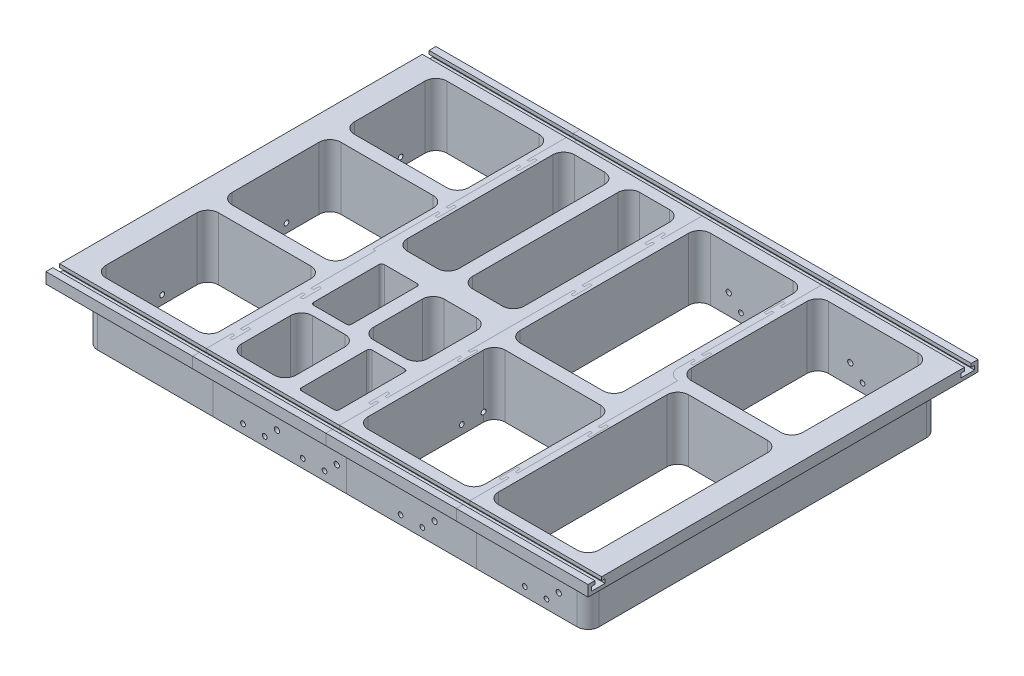
from build123d import *

# Parameters (mm, degrees)
SKETCH1_W                  = 399
SKETCH1_H                  = 287
BOSS_EXTRUDE1_DEPTH        = 53
SKETCH3_OUTSIDE_W          = 499.87
SKETCH3_OUTSIDE_H          = 387.87
SKETCH3_OUTSIDE_W_2        = 369
SKETCH3_OUTSIDE_H_2        = 257
CUT_EXTRUDE2_DEPTH         = 45
MINI_BIN_CUTS_DEPTH        = 46
FILLET1_R                  = 8
SKETCH6_W                  = 257
SKETCH6_H                  = 7
CUT_EXTRUDE5_DEPTH         = 414.348823634
SKETCH7_R                  = 1.75
SKETCH7_R_2                = 1.95
HOLES_LIDS_1_2_3_DEPTH     = 3
SKETCH8_R                  = 1.75
SKETCH8_R_2                = 1.95
HOLES_LIDS_8_9_12_13_DEPTH = 3
SKETCH9_R                  = 1.75
SKETCH9_R_2                = 1.95
HOLES_LIDS_4_5_10_11_DEPTH = 3
HOLE_LID_7_REACH           = 256.185
SKETCH11_R                 = 1.75
HOLE_START                 = -15
SKETCH12_R                 = 1.75
HOLE_LID_6_DEPTH           = 15
SKETCH13_R                 = 1.95
SERVO_BRACKETS_6_7_DEPTH   = 15
SPLIT2_SURFACE_1_1_BACK    = 494.646
SPLIT2_SURFACE_1_1_DEPTH   = 989.292
SPLIT2_SURFACE_1_2_BACK    = 494.646
SPLIT2_SURFACE_1_2_DEPTH   = 989.292
SPLIT2_SURFACE_2_3_BACK    = 494.646
SPLIT2_SURFACE_2_3_DEPTH   = 989.292
SPLIT2_SURFACE_2_4_BACK    = 494.646
SPLIT2_SURFACE_2_4_DEPTH   = 989.292
SPLIT2_SURFACE_3_5_BACK    = 494.646
SPLIT2_SURFACE_3_5_DEPTH   = 989.292
SPLIT2_SURFACE_3_6_BACK    = 494.646
SPLIT2_SURFACE_3_6_DEPTH   = 989.292
STRUCTURAL_CUTS_DEPTH      = 428.319845093


with BuildPart() as part:
    # Sketch1 → Boss-Extrude1 (new body)
    with BuildSketch(Plane(origin=(0, 0, 0), x_dir=(1, 0, 0), z_dir=(0, 1, 0))):
        Rectangle(SKETCH1_W, SKETCH1_H)
    extrude(amount=BOSS_EXTRUDE1_DEPTH)

    # Sketch3 outside → Cut-Extrude2 (cut)
    with BuildSketch(Plane(origin=(0, 0, 0), x_dir=(-1, 0, 0), z_dir=(0, -1, 0))):
        Rectangle(SKETCH3_OUTSIDE_W, SKETCH3_OUTSIDE_H)
        Rectangle(SKETCH3_OUTSIDE_W_2, SKETCH3_OUTSIDE_H_2, mode=Mode.SUBTRACT)
    extrude(amount=-CUT_EXTRUDE2_DEPTH, mode=Mode.SUBTRACT)

    # Sketch2 → Mini bin cuts (cut)
    with BuildSketch(Plane(origin=(0, 53, 0), x_dir=(1, 0, 0), z_dir=(0, 1, 0))):
        with BuildLine():
            Line((-173.5, -125.5), (-105.5, -125.5))
            ThreePointArc((-105.5, -125.5), (-99.843145751, -123.156854249), (-97.5, -117.5))
            Line((-97.5, -117.5), (-97.5, -50.5))
            ThreePointArc((-97.5, -50.5), (-99.843145751, -44.843145751), (-105.5, -42.5))
            Line((-105.5, -42.5), (-173.5, -42.5))
            ThreePointArc((-173.5, -42.5), (-179.156854249, -44.843145751), (-181.5, -50.5))
            Line((-181.5, -50.5), (-181.5, -117.5))
            ThreePointArc((-181.5, -117.5), (-179.156854249, -123.156854249), (-173.5, -125.5))
        make_face()
        with BuildLine():
            Line((-173.5, -32.5), (-105.5, -32.5))
            ThreePointArc((-105.5, -32.5), (-99.843145751, -30.156854249), (-97.5, -24.5))
            Line((-97.5, -24.5), (-97.5, 39.5))
            ThreePointArc((-97.5, 39.5), (-99.843145751, 45.156854249), (-105.5, 47.5))
            Line((-105.5, 47.5), (-173.5, 47.5))
            ThreePointArc((-173.5, 47.5), (-179.156854249, 45.156854249), (-181.5, 39.5))
            Line((-181.5, 39.5), (-181.5, -24.5))
            ThreePointArc((-181.5, -24.5), (-179.156854249, -30.156854249), (-173.5, -32.5))
        make_face()
        with BuildLine():
            Line((-173.5, 125.5), (-105.5, 125.5))
            ThreePointArc((-105.5, 125.5), (-99.843145751, 123.156854249), (-97.5, 117.5))
            Line((-97.5, 117.5), (-97.5, 65.5))
            ThreePointArc((-97.5, 65.5), (-99.843145751, 59.843145751), (-105.5, 57.5))
            Line((-105.5, 57.5), (-173.5, 57.5))
            ThreePointArc((-173.5, 57.5), (-179.156854249, 59.843145751), (-181.5, 65.5))
            Line((-181.5, 65.5), (-181.5, 117.5))
            ThreePointArc((-181.5, 117.5), (-179.156854249, 123.156854249), (-173.5, 125.5))
        make_face()
        with BuildLine():
            Line((173.5, -125.5), (115.5, -125.5))
            ThreePointArc((115.5, -125.5), (109.843145751, -123.156854249), (107.5, -117.5))
            Line((107.5, -117.5), (107.5, 6.5))
            ThreePointArc((107.5, 6.5), (109.843145751, 12.156854249), (115.5, 14.5))
            Line((115.5, 14.5), (173.5, 14.5))
            ThreePointArc((173.5, 14.5), (179.156854249, 12.156854249), (181.5, 6.5))
            Line((181.5, 6.5), (181.5, -117.5))
            ThreePointArc((181.5, -117.5), (179.156854249, -123.156854249), (173.5, -125.5))
        make_face()
        with BuildLine():
            Line((173.5, 125.5), (107.5, 125.5))
            ThreePointArc((107.5, 125.5), (101.843145751, 123.156854249), (99.5, 117.5))
            Line((99.5, 117.5), (99.5, 32.5))
            ThreePointArc((99.5, 32.5), (101.843145751, 26.843145751), (107.5, 24.5))
            Line((107.5, 24.5), (173.5, 24.5))
            ThreePointArc((173.5, 24.5), (179.156854249, 26.843145751), (181.5, 32.5))
            Line((181.5, 32.5), (181.5, 117.5))
            ThreePointArc((181.5, 117.5), (179.156854249, 123.156854249), (173.5, 125.5))
        make_face()
        with BuildLine():
            Line((81.5, 125.5), (20.5, 125.5))
            ThreePointArc((20.5, 125.5), (14.843145751, 123.156854249), (12.5, 117.5))
            Line((12.5, 117.5), (12.5, -6.5))
            ThreePointArc((12.5, -6.5), (14.843145751, -12.156854249), (20.5, -14.5))
            Line((20.5, -14.5), (81.5, -14.5))
            ThreePointArc((81.5, -14.5), (87.156854249, -12.156854249), (89.5, -6.5))
            Line((89.5, -6.5), (89.5, 117.5))
            ThreePointArc((89.5, 117.5), (87.156854249, 123.156854249), (81.5, 125.5))
        make_face()
        with BuildLine():
            Line((-9.5, 125.5), (-31.5, 125.5))
            ThreePointArc((-31.5, 125.5), (-37.156854249, 123.156854249), (-39.5, 117.5))
            Line((-39.5, 117.5), (-39.5, 10.5))
            ThreePointArc((-39.5, 10.5), (-37.156854249, 4.843145751), (-31.5, 2.5))
            Line((-31.5, 2.5), (-9.5, 2.5))
            ThreePointArc((-9.5, 2.5), (-3.843145751, 4.843145751), (-1.5, 10.5))
            Line((-1.5, 10.5), (-1.5, 117.5))
            ThreePointArc((-1.5, 117.5), (-3.843145751, 123.156854249), (-9.5, 125.5))
        make_face()
        with BuildLine():
            Line((-57.5, 125.5), (-79.5, 125.5))
            ThreePointArc((-79.5, 125.5), (-85.156854249, 123.156854249), (-87.5, 117.5))
            Line((-87.5, 117.5), (-87.5, 10.5))
            ThreePointArc((-87.5, 10.5), (-85.156854249, 4.843145751), (-79.5, 2.5))
            Line((-79.5, 2.5), (-57.5, 2.5))
            ThreePointArc((-57.5, 2.5), (-51.843145751, 4.843145751), (-49.5, 10.5))
            Line((-49.5, 10.5), (-49.5, 117.5))
            ThreePointArc((-49.5, 117.5), (-51.843145751, 123.156854249), (-57.5, 125.5))
        make_face()
        with BuildLine():
            Line((-79.5, -14.5), (-55.5, -14.5))
            ThreePointArc((-55.5, -14.5), (-54.085786438, -15.085786438), (-53.5, -16.5))
            Line((-53.5, -16.5), (-53.5, -64.5))
            ThreePointArc((-53.5, -64.5), (-54.085786438, -65.914213562), (-55.5, -66.5))
            Line((-55.5, -66.5), (-79.5, -66.5))
            ThreePointArc((-79.5, -66.5), (-80.914213562, -65.914213562), (-81.5, -64.5))
            Line((-81.5, -64.5), (-81.5, -16.5))
            ThreePointArc((-81.5, -16.5), (-80.914213562, -15.085786438), (-79.5, -14.5))
        make_face()
        with BuildLine():
            Line((-73.5, -125.5), (-49.5, -125.5))
            ThreePointArc((-49.5, -125.5), (-43.843145751, -123.156854249), (-41.5, -117.5))
            Line((-41.5, -117.5), (-41.5, -81.5))
            ThreePointArc((-41.5, -81.5), (-43.843145751, -75.843145751), (-49.5, -73.5))
            Line((-49.5, -73.5), (-73.5, -73.5))
            ThreePointArc((-73.5, -73.5), (-79.156854249, -75.843145751), (-81.5, -81.5))
            Line((-81.5, -81.5), (-81.5, -117.5))
            ThreePointArc((-81.5, -117.5), (-79.156854249, -123.156854249), (-73.5, -125.5))
        make_face()
        with BuildLine():
            Line((-35.5, -14.5), (-11.5, -14.5))
            ThreePointArc((-11.5, -14.5), (-5.843145751, -16.843145751), (-3.5, -22.5))
            Line((-3.5, -22.5), (-3.5, -58.5))
            ThreePointArc((-3.5, -58.5), (-5.843145751, -64.156854249), (-11.5, -66.5))
            Line((-11.5, -66.5), (-35.5, -66.5))
            ThreePointArc((-35.5, -66.5), (-41.156854249, -64.156854249), (-43.5, -58.5))
            Line((-43.5, -58.5), (-43.5, -22.5))
            ThreePointArc((-43.5, -22.5), (-41.156854249, -16.843145751), (-35.5, -14.5))
        make_face()
        with BuildLine():
            Line((-29.5, -73.5), (-5.5, -73.5))
            ThreePointArc((-5.5, -73.5), (-4.085786438, -74.085786438), (-3.5, -75.5))
            Line((-3.5, -75.5), (-3.5, -123.5))
            ThreePointArc((-3.5, -123.5), (-4.085786438, -124.914213562), (-5.5, -125.5))
            Line((-5.5, -125.5), (-29.5, -125.5))
            ThreePointArc((-29.5, -125.5), (-30.914213562, -124.914213562), (-31.5, -123.5))
            Line((-31.5, -123.5), (-31.5, -75.5))
            ThreePointArc((-31.5, -75.5), (-30.914213562, -74.085786438), (-29.5, -73.5))
        make_face()
        with BuildLine():
            Line((89.5, -125.5), (19.5, -125.5))
            ThreePointArc((19.5, -125.5), (13.843145751, -123.156854249), (11.5, -117.5))
            Line((11.5, -117.5), (11.5, -32.5))
            ThreePointArc((11.5, -32.5), (13.843145751, -26.843145751), (19.5, -24.5))
            Line((19.5, -24.5), (89.5, -24.5))
            ThreePointArc((89.5, -24.5), (95.156854249, -26.843145751), (97.5, -32.5))
            Line((97.5, -32.5), (97.5, -117.5))
            ThreePointArc((97.5, -117.5), (95.156854249, -123.156854249), (89.5, -125.5))
        make_face()
    extrude(amount=-MINI_BIN_CUTS_DEPTH, mode=Mode.SUBTRACT)

    # Fillet1
    fillet1_edges = [part.edges().sort_by_distance(p)[0] for p in [
        (184.5, 22.5, 128.5),
        (184.5, 22.5, -128.5),
        (-184.5, 22.5, -128.5),
        (-184.5, 22.5, 128.5),
    ]]
    fillet(fillet1_edges, radius=FILLET1_R)

    # Sketch6 → Cut-Extrude5 (cut, through all)
    with BuildSketch(Plane.ZY.offset(184.5)):
        with Locations((0, 3.5)):
            Rectangle(SKETCH6_W, SKETCH6_H)
    extrude(amount=-CUT_EXTRUDE5_DEPTH, mode=Mode.SUBTRACT)

    # Sketch7 → Holes Lids 1,2,3 (cut)
    with BuildSketch(Plane.ZY.offset(184.5)):
        with Locations((-99.5, 13.5)):
            Circle(SKETCH7_R)
        with Locations((-83.5, 13.5)):
            Circle(SKETCH7_R)
        with Locations((-15.5, 13.5)):
            Circle(SKETCH7_R)
        with Locations((76, 13.5)):
            Circle(SKETCH7_R)
        with Locations((0.5, 13.5)):
            Circle(SKETCH7_R)
        with Locations((92, 13.5)):
            Circle(SKETCH7_R)
        with Locations((-74.5, 21.963)):
            Circle(SKETCH7_R_2)
        with Locations((101, 21.963)):
            Circle(SKETCH7_R_2)
        with Locations((9.5, 21.963)):
            Circle(SKETCH7_R_2)
    extrude(amount=-HOLES_LIDS_1_2_3_DEPTH, mode=Mode.SUBTRACT)

    # Sketch8 → Holes Lids 8,9,12,13 (cut)
    with BuildSketch(Plane.XY.offset(128.5)):
        with Locations((-69.5, 13.5)):
            Circle(SKETCH8_R)
        with Locations((-25.5, 13.5)):
            Circle(SKETCH8_R)
        with Locations((46.5, 13.5)):
            Circle(SKETCH8_R)
        with Locations((137.896, 13.5)):
            Circle(SKETCH8_R)
        with Locations((153.896, 13.5)):
            Circle(SKETCH8_R)
        with Locations((62.5, 13.5)):
            Circle(SKETCH8_R)
        with Locations((-9.5, 13.5)):
            Circle(SKETCH8_R)
        with Locations((-53.5, 13.5)):
            Circle(SKETCH8_R)
        with Locations((-44.5, 21.96)):
            Circle(SKETCH8_R_2)
        with Locations((-0.5, 21.96)):
            Circle(SKETCH8_R_2)
        with Locations((71.5, 21.96)):
            Circle(SKETCH8_R_2)
        with Locations((162.896, 21.96)):
            Circle(SKETCH8_R_2)
    extrude(amount=-HOLES_LIDS_8_9_12_13_DEPTH, mode=Mode.SUBTRACT)

    # Sketch9 → Holes Lids 4,5,10,11 (cut)
    with BuildSketch(Plane(origin=(0, 0, -128.5), x_dir=(-1, 0, 0), z_dir=(0, 0, -1))):
        with Locations((-148.5, 13.5)):
            Circle(SKETCH9_R)
        with Locations((-59, 13.5)):
            Circle(SKETCH9_R)
        with Locations((12.5, 13.5)):
            Circle(SKETCH9_R)
        with Locations((60.5, 13.5)):
            Circle(SKETCH9_R)
        with Locations((-132.5, 13.5)):
            Circle(SKETCH9_R)
        with Locations((-43, 13.5)):
            Circle(SKETCH9_R)
        with Locations((28.5, 13.5)):
            Circle(SKETCH9_R)
        with Locations((76.5, 13.5)):
            Circle(SKETCH9_R)
        with Locations((-123.5, 21.96)):
            Circle(SKETCH9_R_2)
        with Locations((-34, 21.96)):
            Circle(SKETCH9_R_2)
        with Locations((37.5, 21.96)):
            Circle(SKETCH9_R_2)
        with Locations((85.5, 21.96)):
            Circle(SKETCH9_R_2)
    extrude(amount=-HOLES_LIDS_4_5_10_11_DEPTH, mode=Mode.SUBTRACT)

    # Sketch11 → Hole Lid 7 (cut, up to next)
    with BuildSketch(Plane.ZY.offset(3.5), mode=Mode.PRIVATE) as hole_lid_7_sk1:
        with Locations((32.5, 13.5)):
            Circle(SKETCH11_R)
    hole_lid_7_tool1 = extrude(hole_lid_7_sk1.sketch, amount=-HOLE_LID_7_REACH, mode=Mode.PRIVATE) & part.part
    # Sketch11 → Hole Lid 7 (cut, up to next)
    with BuildSketch(Plane.ZY.offset(3.5), mode=Mode.PRIVATE) as hole_lid_7_sk2:
        with Locations((48.5, 13.5)):
            Circle(SKETCH11_R)
    hole_lid_7_tool2 = extrude(hole_lid_7_sk2.sketch, amount=-HOLE_LID_7_REACH, mode=Mode.PRIVATE) & part.part
    add(hole_lid_7_tool1.solids().sort_by_distance((-3.5, 13.5, 32.5))[0], mode=Mode.SUBTRACT)
    add(hole_lid_7_tool2.solids().sort_by_distance((-3.5, 13.5, 48.5))[0], mode=Mode.SUBTRACT)

    # Sketch12 → Hole Lid 6 (cut)
    with BuildSketch(Plane(origin=(-81.5, 0, 0), x_dir=(0, 0, -1), z_dir=(1, 0, 0)).offset(HOLE_START)):
        with Locations(Location((-48.5, 13.5, 0), (0, 0, 180))):
            Circle(SKETCH12_R)
        with Locations(Location((-32.5, 13.5, 0), (0, 0, 180))):
            Circle(SKETCH12_R)
    extrude(amount=HOLE_LID_6_DEPTH, mode=Mode.SUBTRACT)

    # Sketch13 → Servo brackets 6,7, (cut)
    with BuildSketch(Plane.XZ.offset(-7)):
        with Locations(Location((-88.5, 46.5, 0), (0, 0, 270))):
            Circle(SKETCH13_R)
        with Locations(Location((-88.5, 6.37, 0), (0, 0, 90))):
            Circle(SKETCH13_R)
        with Locations(Location((3.5, 17.84, 0), (0, 0, 270))):
            Circle(SKETCH13_R)
        with Locations(Location((3.5, 57.97, 0), (0, 0, 90))):
            Circle(SKETCH13_R)
    extrude(amount=-SERVO_BRACKETS_6_7_DEPTH, mode=Mode.SUBTRACT)


with BuildPart() as body_2:
    # Split2: the piece behind the surface
    add(part.part)
    # Split2 surface 1: a surface, the sketch's curves swept straight by 989.292 mm
    with BuildLine(Plane(origin=(0, 53, 0), x_dir=(1, 0, 0), z_dir=(0, 1, 0)).offset(-SPLIT2_SURFACE_1_1_BACK), mode=Mode.PRIVATE) as split2_surface_1_1_path:
        Line((6.5, 143.5), (6.5, 104.5))
        Line((6.5, 104.5), (5.5, 104.5))
        ThreePointArc((5.5, 104.5), (4.969669914, 104.719669914), (4.75, 105.25))
        Line((4.75, 105.25), (4.75, 107.75))
        ThreePointArc((4.75, 107.75), (4.530330086, 108.280330086), (4, 108.5))
        Line((4, 108.5), (3.5, 108.5))
        ThreePointArc((3.5, 108.5), (2.969669914, 108.280330086), (2.75, 107.75))
        Line((2.75, 107.75), (2.75, 95.25))
        ThreePointArc((2.75, 95.25), (2.969669914, 94.719669914), (3.5, 94.5))
        Line((3.5, 94.5), (4, 94.5))
        ThreePointArc((4, 94.5), (4.530330086, 94.719669914), (4.75, 95.25))
        Line((4.75, 95.25), (4.75, 97.75))
        ThreePointArc((4.75, 97.75), (4.969669914, 98.280330086), (5.5, 98.5))
        Line((5.5, 98.5), (6.5, 98.5))
        Line((6.5, 98.5), (6.5, 45))
        Line((6.5, 45), (8.25, 45))
        Line((8.25, 45), (8.25, 48.25))
        ThreePointArc((8.25, 48.25), (8.469669914, 48.780330086), (9, 49))
        Line((9, 49), (9.5, 49))
        ThreePointArc((9.5, 49), (10.030330086, 48.780330086), (10.25, 48.25))
        Line((10.25, 48.25), (10.25, 35.75))
        ThreePointArc((10.25, 35.75), (10.030330086, 35.219669914), (9.5, 35))
        Line((9.5, 35), (9, 35))
        ThreePointArc((9, 35), (8.469669914, 35.219669914), (8.25, 35.75))
        Line((8.25, 35.75), (8.25, 38.25))
        ThreePointArc((8.25, 38.25), (8.030330086, 38.780330086), (7.5, 39))
        Line((7.5, 39), (7.25, 39))
        ThreePointArc((7.25, 39), (6.719669914, 38.780330086), (6.5, 38.25))
        Line((6.5, 38.25), (6.5, -39))
        Line((6.5, -39), (7.5, -39))
        ThreePointArc((7.5, -39), (8.030330086, -38.780330086), (8.25, -38.25))
        Line((8.25, -38.25), (8.25, -35.75))
        ThreePointArc((8.25, -35.75), (8.469669914, -35.219669914), (9, -35))
        Line((9, -35), (9.5, -35))
        ThreePointArc((9.5, -35), (10.030330086, -35.219669914), (10.25, -35.75))
        Line((10.25, -35.75), (10.25, -48.25))
        ThreePointArc((10.25, -48.25), (10.030330086, -48.780330086), (9.5, -49))
        Line((9.5, -49), (9, -49))
        ThreePointArc((9, -49), (8.469669914, -48.780330086), (8.25, -48.25))
        Line((8.25, -48.25), (8.25, -45.75))
        ThreePointArc((8.25, -45.75), (8.030330086, -45.219669914), (7.5, -45))
        Line((7.5, -45), (6.5, -45))
        Line((6.5, -45), (6.5, -98.5))
        Line((6.5, -98.5), (5.5, -98.5))
        ThreePointArc((5.5, -98.5), (4.969669914, -98.280330086), (4.75, -97.75))
        Line((4.75, -97.75), (4.75, -95.25))
        ThreePointArc((4.75, -95.25), (4.530330086, -94.719669914), (4, -94.5))
        Line((4, -94.5), (3.5, -94.5))
        ThreePointArc((3.5, -94.5), (2.969669914, -94.719669914), (2.75, -95.25))
        Line((2.75, -95.25), (2.75, -107.75))
        ThreePointArc((2.75, -107.75), (2.969669914, -108.280330086), (3.5, -108.5))
        Line((3.5, -108.5), (4, -108.5))
        ThreePointArc((4, -108.5), (4.530330086, -108.280330086), (4.75, -107.75))
        Line((4.75, -107.75), (4.75, -105.25))
        ThreePointArc((4.75, -105.25), (4.969669914, -104.719669914), (5.5, -104.5))
        Line((5.5, -104.5), (6.5, -104.5))
        Line((6.5, -104.5), (6.5, -143.5))
    split2_surface_1_1 = Shell.extrude(split2_surface_1_1_path.wire(), (0 * SPLIT2_SURFACE_1_1_DEPTH, 1 * SPLIT2_SURFACE_1_1_DEPTH, 0 * SPLIT2_SURFACE_1_1_DEPTH))
    split(bisect_by=split2_surface_1_1, keep=Keep.BOTTOM)


with BuildPart() as part_1:
    add(part.part)

    # Split2: split by a surface, the side it looks to stays
    # Split2 surface 1: a surface, the sketch's curves swept straight by 989.292 mm
    with BuildLine(Plane(origin=(0, 53, 0), x_dir=(1, 0, 0), z_dir=(0, 1, 0)).offset(-SPLIT2_SURFACE_1_2_BACK), mode=Mode.PRIVATE) as split2_surface_1_2_path:
        Line((6.5, 143.5), (6.5, 104.5))
        Line((6.5, 104.5), (5.5, 104.5))
        ThreePointArc((5.5, 104.5), (4.969669914, 104.719669914), (4.75, 105.25))
        Line((4.75, 105.25), (4.75, 107.75))
        ThreePointArc((4.75, 107.75), (4.530330086, 108.280330086), (4, 108.5))
        Line((4, 108.5), (3.5, 108.5))
        ThreePointArc((3.5, 108.5), (2.969669914, 108.280330086), (2.75, 107.75))
        Line((2.75, 107.75), (2.75, 95.25))
        ThreePointArc((2.75, 95.25), (2.969669914, 94.719669914), (3.5, 94.5))
        Line((3.5, 94.5), (4, 94.5))
        ThreePointArc((4, 94.5), (4.530330086, 94.719669914), (4.75, 95.25))
        Line((4.75, 95.25), (4.75, 97.75))
        ThreePointArc((4.75, 97.75), (4.969669914, 98.280330086), (5.5, 98.5))
        Line((5.5, 98.5), (6.5, 98.5))
        Line((6.5, 98.5), (6.5, 45))
        Line((6.5, 45), (8.25, 45))
        Line((8.25, 45), (8.25, 48.25))
        ThreePointArc((8.25, 48.25), (8.469669914, 48.780330086), (9, 49))
        Line((9, 49), (9.5, 49))
        ThreePointArc((9.5, 49), (10.030330086, 48.780330086), (10.25, 48.25))
        Line((10.25, 48.25), (10.25, 35.75))
        ThreePointArc((10.25, 35.75), (10.030330086, 35.219669914), (9.5, 35))
        Line((9.5, 35), (9, 35))
        ThreePointArc((9, 35), (8.469669914, 35.219669914), (8.25, 35.75))
        Line((8.25, 35.75), (8.25, 38.25))
        ThreePointArc((8.25, 38.25), (8.030330086, 38.780330086), (7.5, 39))
        Line((7.5, 39), (7.25, 39))
        ThreePointArc((7.25, 39), (6.719669914, 38.780330086), (6.5, 38.25))
        Line((6.5, 38.25), (6.5, -39))
        Line((6.5, -39), (7.5, -39))
        ThreePointArc((7.5, -39), (8.030330086, -38.780330086), (8.25, -38.25))
        Line((8.25, -38.25), (8.25, -35.75))
        ThreePointArc((8.25, -35.75), (8.469669914, -35.219669914), (9, -35))
        Line((9, -35), (9.5, -35))
        ThreePointArc((9.5, -35), (10.030330086, -35.219669914), (10.25, -35.75))
        Line((10.25, -35.75), (10.25, -48.25))
        ThreePointArc((10.25, -48.25), (10.030330086, -48.780330086), (9.5, -49))
        Line((9.5, -49), (9, -49))
        ThreePointArc((9, -49), (8.469669914, -48.780330086), (8.25, -48.25))
        Line((8.25, -48.25), (8.25, -45.75))
        ThreePointArc((8.25, -45.75), (8.030330086, -45.219669914), (7.5, -45))
        Line((7.5, -45), (6.5, -45))
        Line((6.5, -45), (6.5, -98.5))
        Line((6.5, -98.5), (5.5, -98.5))
        ThreePointArc((5.5, -98.5), (4.969669914, -98.280330086), (4.75, -97.75))
        Line((4.75, -97.75), (4.75, -95.25))
        ThreePointArc((4.75, -95.25), (4.530330086, -94.719669914), (4, -94.5))
        Line((4, -94.5), (3.5, -94.5))
        ThreePointArc((3.5, -94.5), (2.969669914, -94.719669914), (2.75, -95.25))
        Line((2.75, -95.25), (2.75, -107.75))
        ThreePointArc((2.75, -107.75), (2.969669914, -108.280330086), (3.5, -108.5))
        Line((3.5, -108.5), (4, -108.5))
        ThreePointArc((4, -108.5), (4.530330086, -108.280330086), (4.75, -107.75))
        Line((4.75, -107.75), (4.75, -105.25))
        ThreePointArc((4.75, -105.25), (4.969669914, -104.719669914), (5.5, -104.5))
        Line((5.5, -104.5), (6.5, -104.5))
        Line((6.5, -104.5), (6.5, -143.5))
    split2_surface_1_2 = Shell.extrude(split2_surface_1_2_path.wire(), (0 * SPLIT2_SURFACE_1_2_DEPTH, 1 * SPLIT2_SURFACE_1_2_DEPTH, 0 * SPLIT2_SURFACE_1_2_DEPTH))
    split(bisect_by=split2_surface_1_2, keep=Keep.TOP)


with BuildPart() as body_3:
    # Split2 2: the piece behind the surface
    add(part_1.part)
    # Split2 surface 2: a surface, the sketch's curves swept straight by 989.292 mm
    with BuildLine(Plane(origin=(0, 53, 0), x_dir=(1, 0, 0), z_dir=(0, 1, 0)).offset(-SPLIT2_SURFACE_2_3_BACK), mode=Mode.PRIVATE) as split2_surface_2_3_path:
        Line((102.5, -143.5), (102.5, -104.5))
        Line((102.5, -104.5), (101.5, -104.5))
        ThreePointArc((101.5, -104.5), (100.969669914, -104.719669914), (100.75, -105.25))
        Line((100.75, -105.25), (100.75, -107.75))
        ThreePointArc((100.75, -107.75), (100.530330086, -108.280330086), (100, -108.5))
        Line((100, -108.5), (99.5, -108.5))
        ThreePointArc((99.5, -108.5), (98.969669914, -108.280330086), (98.75, -107.75))
        Line((98.75, -107.75), (98.75, -95.25))
        ThreePointArc((98.75, -95.25), (98.969669914, -94.719669914), (99.5, -94.5))
        Line((99.5, -94.5), (100, -94.5))
        ThreePointArc((100, -94.5), (100.530330086, -94.719669914), (100.75, -95.25))
        Line((100.75, -95.25), (100.75, -97.75))
        ThreePointArc((100.75, -97.75), (100.969669914, -98.280330086), (101.5, -98.5))
        Line((101.5, -98.5), (102.5, -98.5))
        Line((102.5, -98.5), (102.5, -45))
        Line((102.5, -45), (103.5, -45))
        ThreePointArc((103.5, -45), (104.030330086, -45.219669914), (104.25, -45.75))
        Line((104.25, -45.75), (104.25, -48.25))
        ThreePointArc((104.25, -48.25), (104.469669914, -48.780330086), (105, -49))
        Line((105, -49), (105.5, -49))
        ThreePointArc((105.5, -49), (106.030330086, -48.780330086), (106.25, -48.25))
        Line((106.25, -48.25), (106.25, -35.75))
        ThreePointArc((106.25, -35.75), (106.030330086, -35.219669914), (105.5, -35))
        Line((105.5, -35), (105, -35))
        ThreePointArc((105, -35), (104.469669914, -35.219669914), (104.25, -35.75))
        Line((104.25, -35.75), (104.25, -38.25))
        ThreePointArc((104.25, -38.25), (104.030330086, -38.780330086), (103.5, -39))
        Line((103.5, -39), (102.5, -39))
        Line((102.5, -39), (102.5, 19.5))
        ThreePointArc((102.5, 19.5), (96.843145751, 21.843145751), (94.5, 27.5))
        Line((94.5, 27.5), (94.5, 39))
        Line((94.5, 39), (95.5, 39))
        ThreePointArc((95.5, 39), (96.030330086, 38.780330086), (96.25, 38.25))
        Line((96.25, 38.25), (96.25, 35.75))
        ThreePointArc((96.25, 35.75), (96.469669914, 35.219669914), (97, 35))
        Line((97, 35), (97.5, 35))
        ThreePointArc((97.5, 35), (98.030330086, 35.219669914), (98.25, 35.75))
        Line((98.25, 35.75), (98.25, 48.25))
        ThreePointArc((98.25, 48.25), (98.030330086, 48.780330086), (97.5, 49))
        Line((97.5, 49), (97, 49))
        ThreePointArc((97, 49), (96.469669914, 48.780330086), (96.25, 48.25))
        Line((96.25, 48.25), (96.25, 45.75))
        ThreePointArc((96.25, 45.75), (96.030330086, 45.219669914), (95.5, 45))
        Line((95.5, 45), (94.5, 45))
        Line((94.5, 45), (94.5, 98.5))
        Line((94.5, 98.5), (93.5, 98.5))
        ThreePointArc((93.5, 98.5), (92.969669914, 98.280330086), (92.75, 97.75))
        Line((92.75, 97.75), (92.75, 95.25))
        ThreePointArc((92.75, 95.25), (92.530330086, 94.719669914), (92, 94.5))
        Line((92, 94.5), (91.5, 94.5))
        ThreePointArc((91.5, 94.5), (90.969669914, 94.719669914), (90.75, 95.25))
        Line((90.75, 95.25), (90.75, 107.75))
        ThreePointArc((90.75, 107.75), (90.969669914, 108.280330086), (91.5, 108.5))
        Line((91.5, 108.5), (92, 108.5))
        ThreePointArc((92, 108.5), (92.530330086, 108.280330086), (92.75, 107.75))
        Line((92.75, 107.75), (92.75, 105.25))
        ThreePointArc((92.75, 105.25), (92.969669914, 104.719669914), (93.5, 104.5))
        Line((93.5, 104.5), (94.5, 104.5))
        Line((94.5, 104.5), (94.5, 143.5))
    split2_surface_2_3 = Shell.extrude(split2_surface_2_3_path.wire(), (0 * SPLIT2_SURFACE_2_3_DEPTH, 1 * SPLIT2_SURFACE_2_3_DEPTH, 0 * SPLIT2_SURFACE_2_3_DEPTH))
    split(bisect_by=split2_surface_2_3, keep=Keep.BOTTOM)


with BuildPart() as part_2:
    add(part_1.part)

    # Split2 2: split by a surface, the side it looks to stays
    # Split2 surface 2: a surface, the sketch's curves swept straight by 989.292 mm
    with BuildLine(Plane(origin=(0, 53, 0), x_dir=(1, 0, 0), z_dir=(0, 1, 0)).offset(-SPLIT2_SURFACE_2_4_BACK), mode=Mode.PRIVATE) as split2_surface_2_4_path:
        Line((102.5, -143.5), (102.5, -104.5))
        Line((102.5, -104.5), (101.5, -104.5))
        ThreePointArc((101.5, -104.5), (100.969669914, -104.719669914), (100.75, -105.25))
        Line((100.75, -105.25), (100.75, -107.75))
        ThreePointArc((100.75, -107.75), (100.530330086, -108.280330086), (100, -108.5))
        Line((100, -108.5), (99.5, -108.5))
        ThreePointArc((99.5, -108.5), (98.969669914, -108.280330086), (98.75, -107.75))
        Line((98.75, -107.75), (98.75, -95.25))
        ThreePointArc((98.75, -95.25), (98.969669914, -94.719669914), (99.5, -94.5))
        Line((99.5, -94.5), (100, -94.5))
        ThreePointArc((100, -94.5), (100.530330086, -94.719669914), (100.75, -95.25))
        Line((100.75, -95.25), (100.75, -97.75))
        ThreePointArc((100.75, -97.75), (100.969669914, -98.280330086), (101.5, -98.5))
        Line((101.5, -98.5), (102.5, -98.5))
        Line((102.5, -98.5), (102.5, -45))
        Line((102.5, -45), (103.5, -45))
        ThreePointArc((103.5, -45), (104.030330086, -45.219669914), (104.25, -45.75))
        Line((104.25, -45.75), (104.25, -48.25))
        ThreePointArc((104.25, -48.25), (104.469669914, -48.780330086), (105, -49))
        Line((105, -49), (105.5, -49))
        ThreePointArc((105.5, -49), (106.030330086, -48.780330086), (106.25, -48.25))
        Line((106.25, -48.25), (106.25, -35.75))
        ThreePointArc((106.25, -35.75), (106.030330086, -35.219669914), (105.5, -35))
        Line((105.5, -35), (105, -35))
        ThreePointArc((105, -35), (104.469669914, -35.219669914), (104.25, -35.75))
        Line((104.25, -35.75), (104.25, -38.25))
        ThreePointArc((104.25, -38.25), (104.030330086, -38.780330086), (103.5, -39))
        Line((103.5, -39), (102.5, -39))
        Line((102.5, -39), (102.5, 19.5))
        ThreePointArc((102.5, 19.5), (96.843145751, 21.843145751), (94.5, 27.5))
        Line((94.5, 27.5), (94.5, 39))
        Line((94.5, 39), (95.5, 39))
        ThreePointArc((95.5, 39), (96.030330086, 38.780330086), (96.25, 38.25))
        Line((96.25, 38.25), (96.25, 35.75))
        ThreePointArc((96.25, 35.75), (96.469669914, 35.219669914), (97, 35))
        Line((97, 35), (97.5, 35))
        ThreePointArc((97.5, 35), (98.030330086, 35.219669914), (98.25, 35.75))
        Line((98.25, 35.75), (98.25, 48.25))
        ThreePointArc((98.25, 48.25), (98.030330086, 48.780330086), (97.5, 49))
        Line((97.5, 49), (97, 49))
        ThreePointArc((97, 49), (96.469669914, 48.780330086), (96.25, 48.25))
        Line((96.25, 48.25), (96.25, 45.75))
        ThreePointArc((96.25, 45.75), (96.030330086, 45.219669914), (95.5, 45))
        Line((95.5, 45), (94.5, 45))
        Line((94.5, 45), (94.5, 98.5))
        Line((94.5, 98.5), (93.5, 98.5))
        ThreePointArc((93.5, 98.5), (92.969669914, 98.280330086), (92.75, 97.75))
        Line((92.75, 97.75), (92.75, 95.25))
        ThreePointArc((92.75, 95.25), (92.530330086, 94.719669914), (92, 94.5))
        Line((92, 94.5), (91.5, 94.5))
        ThreePointArc((91.5, 94.5), (90.969669914, 94.719669914), (90.75, 95.25))
        Line((90.75, 95.25), (90.75, 107.75))
        ThreePointArc((90.75, 107.75), (90.969669914, 108.280330086), (91.5, 108.5))
        Line((91.5, 108.5), (92, 108.5))
        ThreePointArc((92, 108.5), (92.530330086, 108.280330086), (92.75, 107.75))
        Line((92.75, 107.75), (92.75, 105.25))
        ThreePointArc((92.75, 105.25), (92.969669914, 104.719669914), (93.5, 104.5))
        Line((93.5, 104.5), (94.5, 104.5))
        Line((94.5, 104.5), (94.5, 143.5))
    split2_surface_2_4 = Shell.extrude(split2_surface_2_4_path.wire(), (0 * SPLIT2_SURFACE_2_4_DEPTH, 1 * SPLIT2_SURFACE_2_4_DEPTH, 0 * SPLIT2_SURFACE_2_4_DEPTH))
    split(bisect_by=split2_surface_2_4, keep=Keep.TOP)


with BuildPart() as body_4_2:
    # Split2 3 body 2: the piece behind the surface
    add(body_2.part)
    # Split2 surface 3: a surface, the sketch's curves swept straight by 989.292 mm
    with BuildLine(Plane(origin=(0, 53, 0), x_dir=(1, 0, 0), z_dir=(0, 1, 0)).offset(-SPLIT2_SURFACE_3_5_BACK), mode=Mode.PRIVATE) as split2_surface_3_5_path:
        Line((-93.5, 143.5), (-93.5, 104.5))
        Line((-93.5, 104.5), (-92.5, 104.5))
        ThreePointArc((-92.5, 104.5), (-91.969669914, 104.719669914), (-91.75, 105.25))
        Line((-91.75, 105.25), (-91.75, 107.75))
        ThreePointArc((-91.75, 107.75), (-91.530330086, 108.280330086), (-91, 108.5))
        Line((-91, 108.5), (-90.5, 108.5))
        ThreePointArc((-90.5, 108.5), (-89.969669914, 108.280330086), (-89.75, 107.75))
        Line((-89.75, 107.75), (-89.75, 95.25))
        ThreePointArc((-89.75, 95.25), (-89.969669914, 94.719669914), (-90.5, 94.5))
        Line((-90.5, 94.5), (-91, 94.5))
        ThreePointArc((-91, 94.5), (-91.530330086, 94.719669914), (-91.75, 95.25))
        Line((-91.75, 95.25), (-91.75, 97.75))
        ThreePointArc((-91.75, 97.75), (-91.969669914, 98.280330086), (-92.5, 98.5))
        Line((-92.5, 98.5), (-93.5, 98.5))
        Line((-93.5, 98.5), (-93.5, 45))
        Line((-93.5, 45), (-92.5, 45))
        ThreePointArc((-92.5, 45), (-91.969669914, 45.219669914), (-91.75, 45.75))
        Line((-91.75, 45.75), (-91.75, 48.25))
        ThreePointArc((-91.75, 48.25), (-91.530330086, 48.780330086), (-91, 49))
        Line((-91, 49), (-90.5, 49))
        ThreePointArc((-90.5, 49), (-89.969669914, 48.780330086), (-89.75, 48.25))
        Line((-89.75, 48.25), (-89.75, 35.75))
        ThreePointArc((-89.75, 35.75), (-89.969669914, 35.219669914), (-90.5, 35))
        Line((-90.5, 35), (-91, 35))
        ThreePointArc((-91, 35), (-91.530330086, 35.219669914), (-91.75, 35.75))
        Line((-91.75, 35.75), (-91.75, 38.25))
        ThreePointArc((-91.75, 38.25), (-91.969669914, 38.780330086), (-92.5, 39))
        Line((-92.5, 39), (-93.5, 39))
        Line((-93.5, 39), (-93.5, -8))
        ThreePointArc((-93.5, -8), (-93.207106781, -8.707106781), (-92.5, -9))
        Line((-92.5, -9), (-91.5, -9))
        Line((-91.5, -9), (-91.5, -56.5))
        Line((-91.5, -56.5), (-90.25, -56.5))
        ThreePointArc((-90.25, -56.5), (-89.719669914, -56.280330086), (-89.5, -55.75))
        Line((-89.5, -55.75), (-89.5, -53.25))
        ThreePointArc((-89.5, -53.25), (-89.280330086, -52.719669914), (-88.75, -52.5))
        Line((-88.75, -52.5), (-88.25, -52.5))
        ThreePointArc((-88.25, -52.5), (-87.719669914, -52.719669914), (-87.5, -53.25))
        Line((-87.5, -53.25), (-87.5, -65.75))
        ThreePointArc((-87.5, -65.75), (-87.719669914, -66.280330086), (-88.25, -66.5))
        Line((-88.25, -66.5), (-88.75, -66.5))
        ThreePointArc((-88.75, -66.5), (-89.280330086, -66.280330086), (-89.5, -65.75))
        Line((-89.5, -65.75), (-89.5, -63.25))
        ThreePointArc((-89.5, -63.25), (-89.719669914, -62.719669914), (-90.25, -62.5))
        Line((-90.25, -62.5), (-91.5, -62.5))
        Line((-91.5, -62.5), (-91.5, -108.5))
        Line((-91.5, -108.5), (-90.25, -108.5))
        ThreePointArc((-90.25, -108.5), (-89.719669914, -108.280330086), (-89.5, -107.75))
        Line((-89.5, -107.75), (-89.5, -105.25))
        ThreePointArc((-89.5, -105.25), (-89.280330086, -104.719669914), (-88.75, -104.5))
        Line((-88.75, -104.5), (-88.25, -104.5))
        ThreePointArc((-88.25, -104.5), (-87.719669914, -104.719669914), (-87.5, -105.25))
        Line((-87.5, -105.25), (-87.5, -117.75))
        ThreePointArc((-87.5, -117.75), (-87.719669914, -118.280330086), (-88.25, -118.5))
        Line((-88.25, -118.5), (-88.75, -118.5))
        ThreePointArc((-88.75, -118.5), (-89.280330086, -118.280330086), (-89.5, -117.75))
        Line((-89.5, -117.75), (-89.5, -115.25))
        ThreePointArc((-89.5, -115.25), (-89.719669914, -114.719669914), (-90.25, -114.5))
        Line((-90.25, -114.5), (-91.5, -114.5))
        Line((-91.5, -114.5), (-91.5, -143.5))
    split2_surface_3_5 = Shell.extrude(split2_surface_3_5_path.wire(), (0 * SPLIT2_SURFACE_3_5_DEPTH, 1 * SPLIT2_SURFACE_3_5_DEPTH, 0 * SPLIT2_SURFACE_3_5_DEPTH))
    split(bisect_by=split2_surface_3_5, keep=Keep.BOTTOM)


with BuildPart() as body_2_1:
    add(body_2.part)

    # Split2 3 body 2: split by a surface, the side it looks to stays
    # Split2 surface 3: a surface, the sketch's curves swept straight by 989.292 mm
    with BuildLine(Plane(origin=(0, 53, 0), x_dir=(1, 0, 0), z_dir=(0, 1, 0)).offset(-SPLIT2_SURFACE_3_6_BACK), mode=Mode.PRIVATE) as split2_surface_3_6_path:
        Line((-93.5, 143.5), (-93.5, 104.5))
        Line((-93.5, 104.5), (-92.5, 104.5))
        ThreePointArc((-92.5, 104.5), (-91.969669914, 104.719669914), (-91.75, 105.25))
        Line((-91.75, 105.25), (-91.75, 107.75))
        ThreePointArc((-91.75, 107.75), (-91.530330086, 108.280330086), (-91, 108.5))
        Line((-91, 108.5), (-90.5, 108.5))
        ThreePointArc((-90.5, 108.5), (-89.969669914, 108.280330086), (-89.75, 107.75))
        Line((-89.75, 107.75), (-89.75, 95.25))
        ThreePointArc((-89.75, 95.25), (-89.969669914, 94.719669914), (-90.5, 94.5))
        Line((-90.5, 94.5), (-91, 94.5))
        ThreePointArc((-91, 94.5), (-91.530330086, 94.719669914), (-91.75, 95.25))
        Line((-91.75, 95.25), (-91.75, 97.75))
        ThreePointArc((-91.75, 97.75), (-91.969669914, 98.280330086), (-92.5, 98.5))
        Line((-92.5, 98.5), (-93.5, 98.5))
        Line((-93.5, 98.5), (-93.5, 45))
        Line((-93.5, 45), (-92.5, 45))
        ThreePointArc((-92.5, 45), (-91.969669914, 45.219669914), (-91.75, 45.75))
        Line((-91.75, 45.75), (-91.75, 48.25))
        ThreePointArc((-91.75, 48.25), (-91.530330086, 48.780330086), (-91, 49))
        Line((-91, 49), (-90.5, 49))
        ThreePointArc((-90.5, 49), (-89.969669914, 48.780330086), (-89.75, 48.25))
        Line((-89.75, 48.25), (-89.75, 35.75))
        ThreePointArc((-89.75, 35.75), (-89.969669914, 35.219669914), (-90.5, 35))
        Line((-90.5, 35), (-91, 35))
        ThreePointArc((-91, 35), (-91.530330086, 35.219669914), (-91.75, 35.75))
        Line((-91.75, 35.75), (-91.75, 38.25))
        ThreePointArc((-91.75, 38.25), (-91.969669914, 38.780330086), (-92.5, 39))
        Line((-92.5, 39), (-93.5, 39))
        Line((-93.5, 39), (-93.5, -8))
        ThreePointArc((-93.5, -8), (-93.207106781, -8.707106781), (-92.5, -9))
        Line((-92.5, -9), (-91.5, -9))
        Line((-91.5, -9), (-91.5, -56.5))
        Line((-91.5, -56.5), (-90.25, -56.5))
        ThreePointArc((-90.25, -56.5), (-89.719669914, -56.280330086), (-89.5, -55.75))
        Line((-89.5, -55.75), (-89.5, -53.25))
        ThreePointArc((-89.5, -53.25), (-89.280330086, -52.719669914), (-88.75, -52.5))
        Line((-88.75, -52.5), (-88.25, -52.5))
        ThreePointArc((-88.25, -52.5), (-87.719669914, -52.719669914), (-87.5, -53.25))
        Line((-87.5, -53.25), (-87.5, -65.75))
        ThreePointArc((-87.5, -65.75), (-87.719669914, -66.280330086), (-88.25, -66.5))
        Line((-88.25, -66.5), (-88.75, -66.5))
        ThreePointArc((-88.75, -66.5), (-89.280330086, -66.280330086), (-89.5, -65.75))
        Line((-89.5, -65.75), (-89.5, -63.25))
        ThreePointArc((-89.5, -63.25), (-89.719669914, -62.719669914), (-90.25, -62.5))
        Line((-90.25, -62.5), (-91.5, -62.5))
        Line((-91.5, -62.5), (-91.5, -108.5))
        Line((-91.5, -108.5), (-90.25, -108.5))
        ThreePointArc((-90.25, -108.5), (-89.719669914, -108.280330086), (-89.5, -107.75))
        Line((-89.5, -107.75), (-89.5, -105.25))
        ThreePointArc((-89.5, -105.25), (-89.280330086, -104.719669914), (-88.75, -104.5))
        Line((-88.75, -104.5), (-88.25, -104.5))
        ThreePointArc((-88.25, -104.5), (-87.719669914, -104.719669914), (-87.5, -105.25))
        Line((-87.5, -105.25), (-87.5, -117.75))
        ThreePointArc((-87.5, -117.75), (-87.719669914, -118.280330086), (-88.25, -118.5))
        Line((-88.25, -118.5), (-88.75, -118.5))
        ThreePointArc((-88.75, -118.5), (-89.280330086, -118.280330086), (-89.5, -117.75))
        Line((-89.5, -117.75), (-89.5, -115.25))
        ThreePointArc((-89.5, -115.25), (-89.719669914, -114.719669914), (-90.25, -114.5))
        Line((-90.25, -114.5), (-91.5, -114.5))
        Line((-91.5, -114.5), (-91.5, -143.5))
    split2_surface_3_6 = Shell.extrude(split2_surface_3_6_path.wire(), (0 * SPLIT2_SURFACE_3_6_DEPTH, 1 * SPLIT2_SURFACE_3_6_DEPTH, 0 * SPLIT2_SURFACE_3_6_DEPTH))
    split(bisect_by=split2_surface_3_6, keep=Keep.TOP)


with BuildPart() as structural_cuts_tool:
    # Sketch14 → Structural Cuts (new, through all)
    with BuildSketch(Plane.ZY.offset(199.5)):
        Polygon((133.5, 53), (133.5, 50.5), (131, 50.5), (131, 47.5), (141, 47.5), (141, 50.5), (138.5, 50.5), (138.5, 53), align=None)
        Polygon((-138.5, 53), (-133.5, 53), (-133.5, 50.5), (-131, 50.5), (-131, 47.5), (-141, 47.5), (-141, 50.5), (-138.5, 50.5), align=None)
    extrude(amount=-STRUCTURAL_CUTS_DEPTH)


with BuildPart() as part_3:
    add(part_2.part)

    # Structural Cuts: cut by structural_cuts_tool
    add(structural_cuts_tool.part, mode=Mode.SUBTRACT)


with BuildPart() as body_2_2:
    add(body_2_1.part)

    # Structural Cuts: cut by structural_cuts_tool
    add(structural_cuts_tool.part, mode=Mode.SUBTRACT)


with BuildPart() as body_3_1:
    add(body_3.part)

    # Structural Cuts: cut by structural_cuts_tool
    add(structural_cuts_tool.part, mode=Mode.SUBTRACT)


with BuildPart() as body_4_2_1:
    add(body_4_2.part)

    # Structural Cuts: cut by structural_cuts_tool
    add(structural_cuts_tool.part, mode=Mode.SUBTRACT)


solid = Compound([part_3.part, body_2_2.part, body_3_1.part, body_4_2_1.part])
